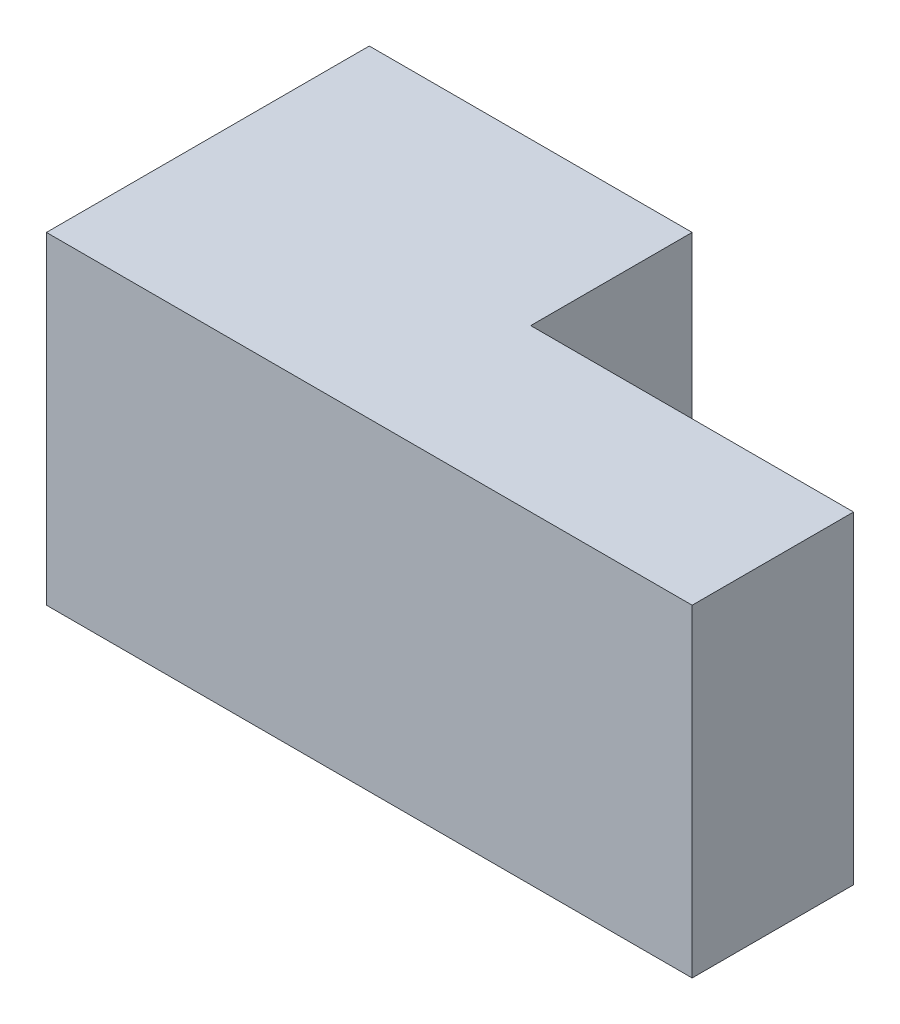
from build123d import *

# Parameters (mm, degrees)
SKETCH1_W           = 12.7
SKETCH1_H           = 12.7
BOSS_EXTRUDE1_DEPTH = 12.7
SKETCH2_W           = 6.35
SKETCH2_H           = 12.7
BOSS_EXTRUDE2_DEPTH = 12.7


with BuildPart() as part:
    # Sketch1 → Boss-Extrude1 (new body)
    with BuildSketch(Plane.XY):
        with Locations((6.35, 6.35)):
            Rectangle(SKETCH1_W, SKETCH1_H)
    extrude(amount=BOSS_EXTRUDE1_DEPTH)

    # Sketch2 → Boss-Extrude2 (add)
    with BuildSketch(Plane(origin=(12.7, 0, 0), x_dir=(0, 0, -1), z_dir=(1, 0, 0))):
        with Locations((-9.525, 6.35)):
            Rectangle(SKETCH2_W, SKETCH2_H)
    extrude(amount=BOSS_EXTRUDE2_DEPTH)


solid = part.part
